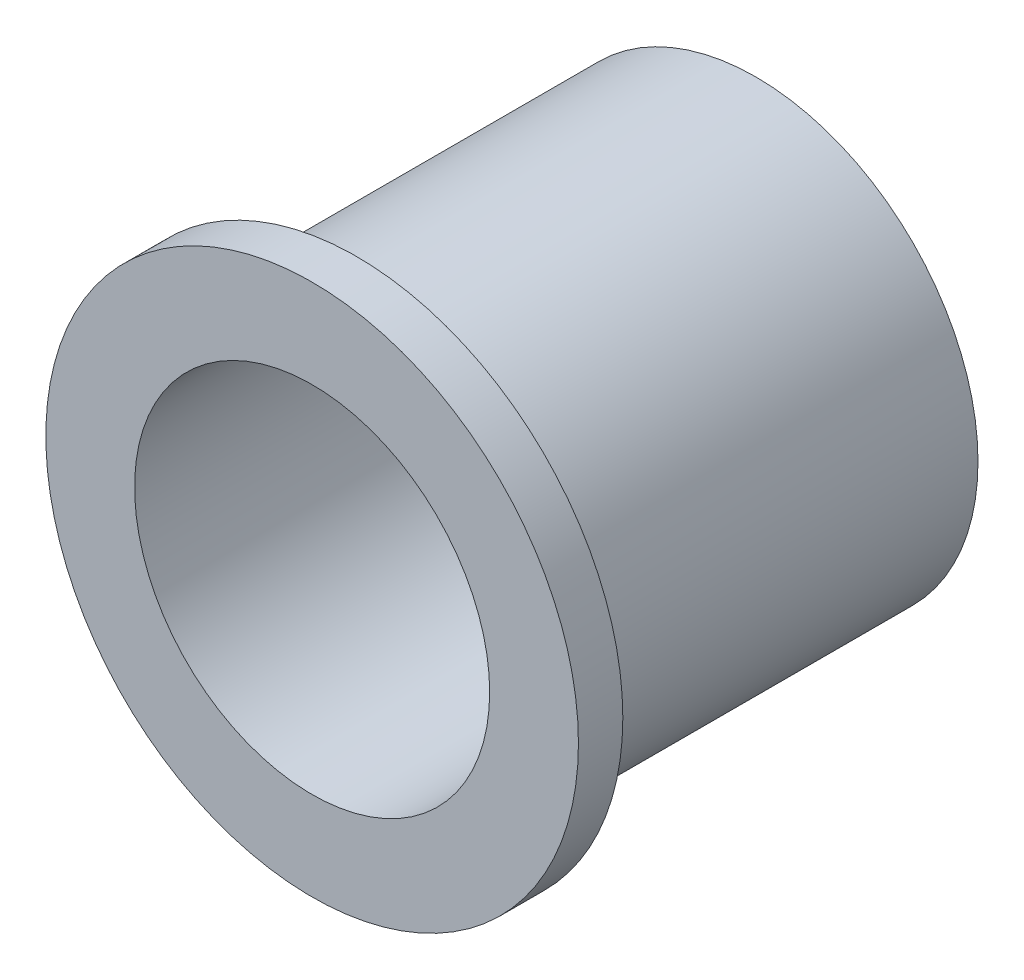
from build123d import *

# Parameters (mm, degrees)
BOSS_EXTRUDE1_DEPTH      = 15.875
BOSS_EXTRUDE1_DEPTH_BACK = 15.875
SKETCH3_R                = 15.88135
SKETCH3_R_2              = 12.7
BOSS_EXTRUDE2_START      = 12.7
SKETCH4_R                = 19.05
SKETCH4_R_2              = 12.7
BOSS_EXTRUDE2_DEPTH      = 3.175


with BuildPart() as part:
    # Sketch3 → Boss-Extrude1 (new, two sides: drawn at the far end of the back side and taken through both)
    with BuildSketch(Plane.XY.offset(-BOSS_EXTRUDE1_DEPTH_BACK)):
        Circle(SKETCH3_R)
        Circle(SKETCH3_R_2, mode=Mode.SUBTRACT)
    extrude(amount=BOSS_EXTRUDE1_DEPTH + BOSS_EXTRUDE1_DEPTH_BACK)

    # Sketch4 → Boss-Extrude2 (add)
    with BuildSketch(Plane.XY.offset(BOSS_EXTRUDE2_START)):
        Circle(SKETCH4_R)
        Circle(SKETCH4_R_2, mode=Mode.SUBTRACT)
    extrude(amount=BOSS_EXTRUDE2_DEPTH)


solid = part.part
